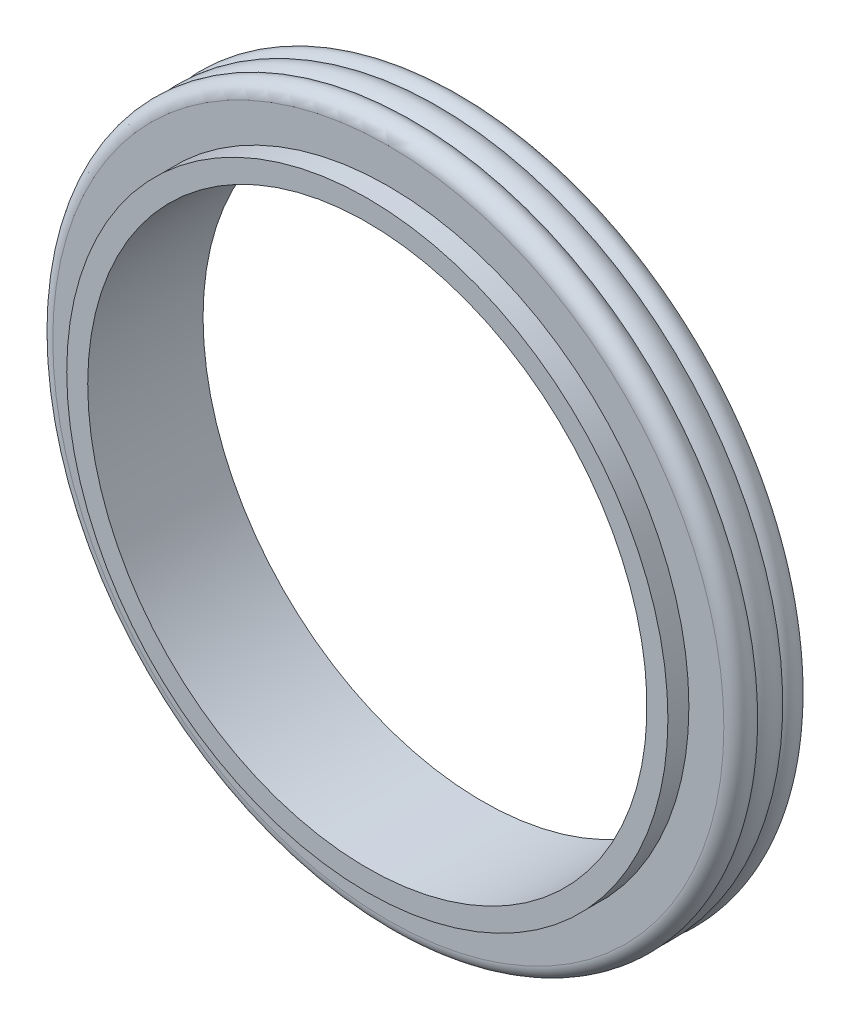
from build123d import *


with BuildPart() as part:
    # Sketch1 → Revolve1 (revolve)
    with BuildSketch(Plane(origin=(0, 0, 0), x_dir=(0, 0, -1), z_dir=(1, 0, 0)), mode=Mode.PRIVATE) as revolve1_sk:
        with BuildLine():
            Line((8.25, 40), (-8.25, 40))
            Line((-8.25, 40), (-8.25, 43))
            Line((-8.25, 43), (-5.25, 43))
            Line((-5.25, 43), (-5.25, 48))
            ThreePointArc((-5.25, 48), (-3.991619849, 49.857417562), (-1.8, 49.377497731))
            ThreePointArc((-1.8, 49.377497731), (0, 49.977497731), (1.8, 49.377497731))
            ThreePointArc((1.8, 49.377497731), (3.991619849, 49.857417562), (5.25, 48))
            Line((5.25, 48), (5.25, 43))
            Line((5.25, 43), (8.25, 43))
            Line((8.25, 43), (8.25, 40))
        make_face()
    revolve(revolve1_sk.sketch.rotate(Axis((0, 0, 0), (0, 0, 1)), 90), axis=Axis((0, 0, 0), (0, 0, 1)))


solid = part.part
